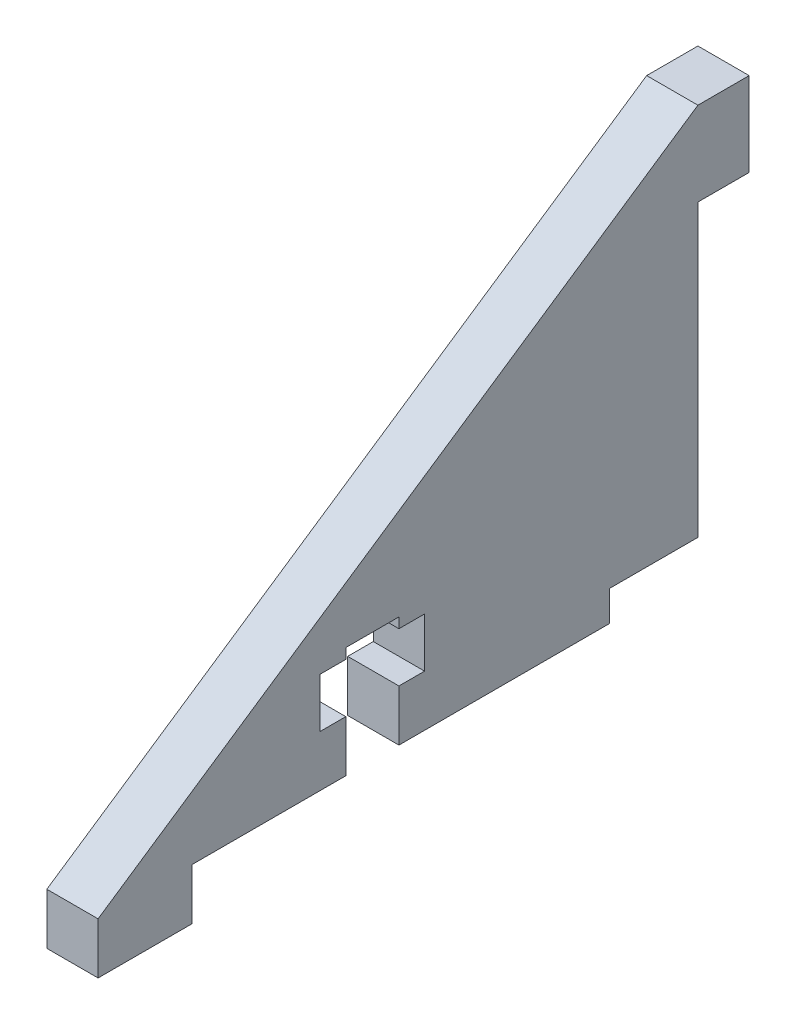
from build123d import *

# Parameters (mm, degrees)
SALIENTE_EXTRUIR1_DEPTH = 3


with BuildPart() as part:
    # Croquis1 → Saliente-Extruir1 (new body)
    with BuildSketch(Plane(origin=(0, 0, 0), x_dir=(0, 0, -1), z_dir=(1, 0, 0))):
        Polygon((0, 0), (9, 0), (9, 3), (7.5, 3), (7.5, 5.9), (9, 5.9), (9, 6.5), (12.11, 6.5), (12.11, 5.9), (13.61, 5.9), (13.61, 3), (12.11, 3), (12.11, 0), (24.44, 0), (24.44, 1.78), (29.61, 1.78), (29.61, 18.78), (32.61, 18.78), (32.61, 23.69), (29.61, 23.69), (-5.5, 0), (-5.5, -3), (0, -3), align=None)
    extrude(amount=SALIENTE_EXTRUIR1_DEPTH)


solid = part.part
